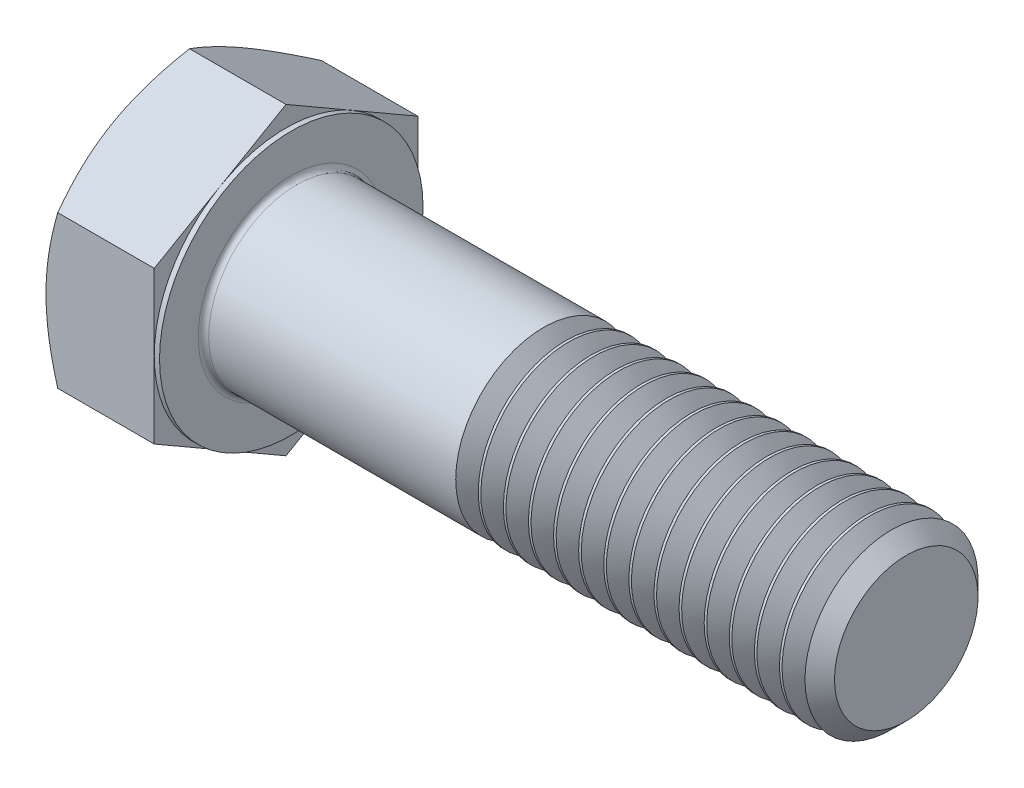
from build123d import *

# Parameters (mm, degrees)
BASEHEAD_DEPTH  = 8.2042
SKETCH4_W       = 0.381
SKETCH4_H       = 26.873522628
HEADFILLET_R    = 0.381
THDSCHPAT_COUNT = 14
THDSCHPAT_PITCH = 1.814285714


with BuildPart() as part:
    # Sketch1 → BaseHead (new body)
    with BuildSketch(Plane(origin=(0, 0, 0), x_dir=(0, 0, -1), z_dir=(1, 0, 0))):
        Polygon((9.525, 5.499261314), (9.525, -5.499261314), (0, -10.998522628), (-9.525, -5.499261314), (-9.525, 5.499261314), (0, 10.998522628), align=None)
    extrude(amount=BASEHEAD_DEPTH)

    # BodySke → BaseBody (revolve)
    with BuildSketch(Plane.XY, mode=Mode.PRIVATE) as basebody_sk:
        Polygon((0, 0), (52.6542, 0), (52.6542, 5.18668), (51.49088, 6.35), (0, 6.35), align=None)
    revolve(basebody_sk.sketch.rotate(Axis((0, 0, 0), (1, 0, 0)), 90), axis=Axis((0, 0, 0), (1, 0, 0)))

    # Sketch3 → HeadChamfer (revolve, cut)
    with BuildSketch(Plane.XY):
        Polygon((0, 9.525), (4.516912895, 17.348522628), (4.516912895, 23.698522628), (-12.7, 23.698522628), (-12.7, 9.525), align=None)
    revolve(axis=Axis((0, 0, 0), (1, 0, 0)), mode=Mode.SUBTRACT)

    # Sketch4 → BearingFace (revolve, cut)
    with BuildSketch(Plane.XY, mode=Mode.PRIVATE) as bearingface_sk:
        with Locations((8.0137, 22.961761314)):
            Rectangle(SKETCH4_W, SKETCH4_H)
    revolve(bearingface_sk.sketch.rotate(Axis((0, 0, 0), (1, 0, 0)), 270), axis=Axis((0, 0, 0), (1, 0, 0)), mode=Mode.SUBTRACT)

    # HeadFillet
    headfillet_edges = [part.edges().sort_by_distance(p)[0] for p in [
        (8.2042, 0, -6.35),
    ]]
    fillet(headfillet_edges, radius=HEADFILLET_R)

    # ThdSchSke → ThreadSchematic (revolve, cut)
    with BuildSketch(Plane.XY):
        Polygon((27.2542, -5.18668), (26.439634567, -6.35), (26.439634567, -7.9375), (28.068765433, -7.9375), (28.068765433, -6.35), align=None)
    threadschematic = revolve(axis=Axis((-3.175, 0, 0), (1, 0, 0)), mode=Mode.SUBTRACT)

    # ThdSchPat: ThreadSchematic ×14
    with Locations(*[(i * THDSCHPAT_PITCH, 0, 0) for i in range(1, THDSCHPAT_COUNT)]):
        add(threadschematic, mode=Mode.SUBTRACT)


solid = part.part
